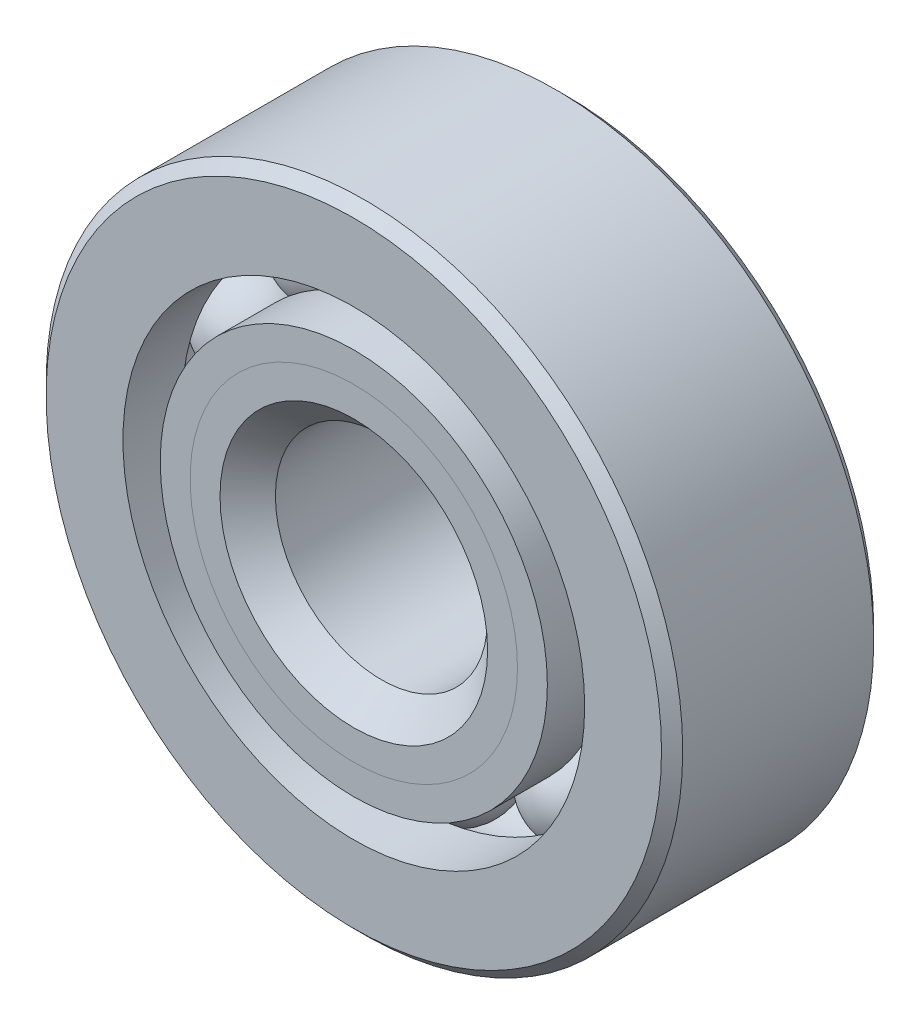
from build123d import *

# Parameters (mm, degrees)
CIRPATTERN1_COUNT = 10


with BuildPart() as part:
    # Sketch1 → Revolve1 (revolve)
    with BuildSketch(Plane(origin=(0, 0, 0), x_dir=(0, 0, -1), z_dir=(1, 0, 0))):
        with BuildLine():
            Line((4.28625, 14.2875), (-4.28625, 14.2875))
            Line((-4.28625, 14.2875), (-4.7625, 13.81125))
            Line((-4.7625, 13.81125), (-4.7625, 10.362362637))
            Line((-4.7625, 10.362362637), (-2.116666667, 10.362362637))
            ThreePointArc((-2.116666667, 10.362362637), (0, 11.801280731), (2.116666667, 10.362362637))
            Line((2.116666667, 10.362362637), (4.7625, 10.362362637))
            Line((4.7625, 10.362362637), (4.7625, 13.81125))
            Line((4.7625, 13.81125), (4.28625, 14.2875))
        make_face()
    revolve(axis=Axis((0, 0, 4.7625), (0, 0, -1)))


with BuildPart() as body_2:
    # Sketch2 → Revolve2 (revolve)
    with BuildSketch(Plane(origin=(0, 0, 0), x_dir=(0, 0, -1), z_dir=(1, 0, 0))):
        with BuildLine():
            Line((-4.7625, 8.687637363), (-2.116666667, 8.687637363))
            ThreePointArc((-2.116666667, 8.687637363), (-1.279722925, 7.642511434), (0, 7.248719269))
            Line((0, 7.248719269), (0, 6.005609635))
            Line((0, 6.005609635), (-3.421486136, 6.005609635))
            Line((-3.421486136, 6.005609635), (-4.7625, 7.346623499))
            Line((-4.7625, 7.346623499), (-4.7625, 8.687637363))
        make_face()
    revolve(axis=Axis((0, 0, 4.7625), (0, 0, -1)))


with BuildPart() as body_3:
    # Sketch3 → Revolve3 (revolve)
    with BuildSketch(Plane(origin=(0, 0, 0), x_dir=(0, 0, -1), z_dir=(1, 0, 0))):
        with BuildLine():
            Line((-4.7625, 7.346623499), (-3.421486136, 6.005609635))
            Line((-3.421486136, 6.005609635), (0, 6.005609635))
            Line((0, 6.005609635), (0, 7.248719269))
            ThreePointArc((0, 7.248719269), (1.279722925, 7.642511434), (2.116666667, 8.687637363))
            Line((2.116666667, 8.687637363), (4.7625, 8.687637363))
            Line((4.7625, 8.687637363), (4.7625, 5.23875))
            Line((4.7625, 5.23875), (4.28625, 4.7625))
            Line((4.28625, 4.7625), (-3.519390365, 4.7625))
            Line((-3.519390365, 4.7625), (-4.7625, 6.005609635))
            Line((-4.7625, 6.005609635), (-4.7625, 7.346623499))
        make_face()
    revolve(axis=Axis((0, 0, 4.7625), (0, 0, -1)))


with BuildPart() as body_4:
    # Sketch4 → Revolve4 (revolve)
    with BuildSketch(Plane(origin=(0, 0, 0), x_dir=(0, 0, -1), z_dir=(1, 0, 0))):
        with BuildLine():
            Line((-2.276280731, 9.525), (2.276280731, 9.525))
            ThreePointArc((2.276280731, 9.525), (0, 11.801280731), (-2.276280731, 9.525))
        make_face()
    revolve(axis=Axis((0, 9.525, 2.276280731), (0, 0, -1)))


with BuildPart() as cirpattern1_1:
    # CirPattern1: pattern copy
    add(body_4.part.rotate(Axis((0, 0, -4.7625), (0, 0, 1)), 1 * 360 / CIRPATTERN1_COUNT))


with BuildPart() as cirpattern1_2:
    # CirPattern1: pattern copy
    add(body_4.part.rotate(Axis((0, 0, -4.7625), (0, 0, 1)), 2 * 360 / CIRPATTERN1_COUNT))


with BuildPart() as cirpattern1_3:
    # CirPattern1: pattern copy
    add(body_4.part.rotate(Axis((0, 0, -4.7625), (0, 0, 1)), 3 * 360 / CIRPATTERN1_COUNT))


with BuildPart() as cirpattern1_4:
    # CirPattern1: pattern copy
    add(body_4.part.rotate(Axis((0, 0, -4.7625), (0, 0, 1)), 4 * 360 / CIRPATTERN1_COUNT))


with BuildPart() as cirpattern1_5:
    # CirPattern1: pattern copy
    add(body_4.part.rotate(Axis((0, 0, -4.7625), (0, 0, 1)), 5 * 360 / CIRPATTERN1_COUNT))


with BuildPart() as cirpattern1_6:
    # CirPattern1: pattern copy
    add(body_4.part.rotate(Axis((0, 0, -4.7625), (0, 0, 1)), 6 * 360 / CIRPATTERN1_COUNT))


with BuildPart() as cirpattern1_7:
    # CirPattern1: pattern copy
    add(body_4.part.rotate(Axis((0, 0, -4.7625), (0, 0, 1)), 7 * 360 / CIRPATTERN1_COUNT))


with BuildPart() as cirpattern1_8:
    # CirPattern1: pattern copy
    add(body_4.part.rotate(Axis((0, 0, -4.7625), (0, 0, 1)), 8 * 360 / CIRPATTERN1_COUNT))


with BuildPart() as cirpattern1_9:
    # CirPattern1: pattern copy
    add(body_4.part.rotate(Axis((0, 0, -4.7625), (0, 0, 1)), 9 * 360 / CIRPATTERN1_COUNT))


solid = Compound([part.part, body_2.part, body_3.part, body_4.part, cirpattern1_1.part, cirpattern1_2.part, cirpattern1_3.part, cirpattern1_4.part, cirpattern1_5.part, cirpattern1_6.part, cirpattern1_7.part, cirpattern1_8.part, cirpattern1_9.part])
